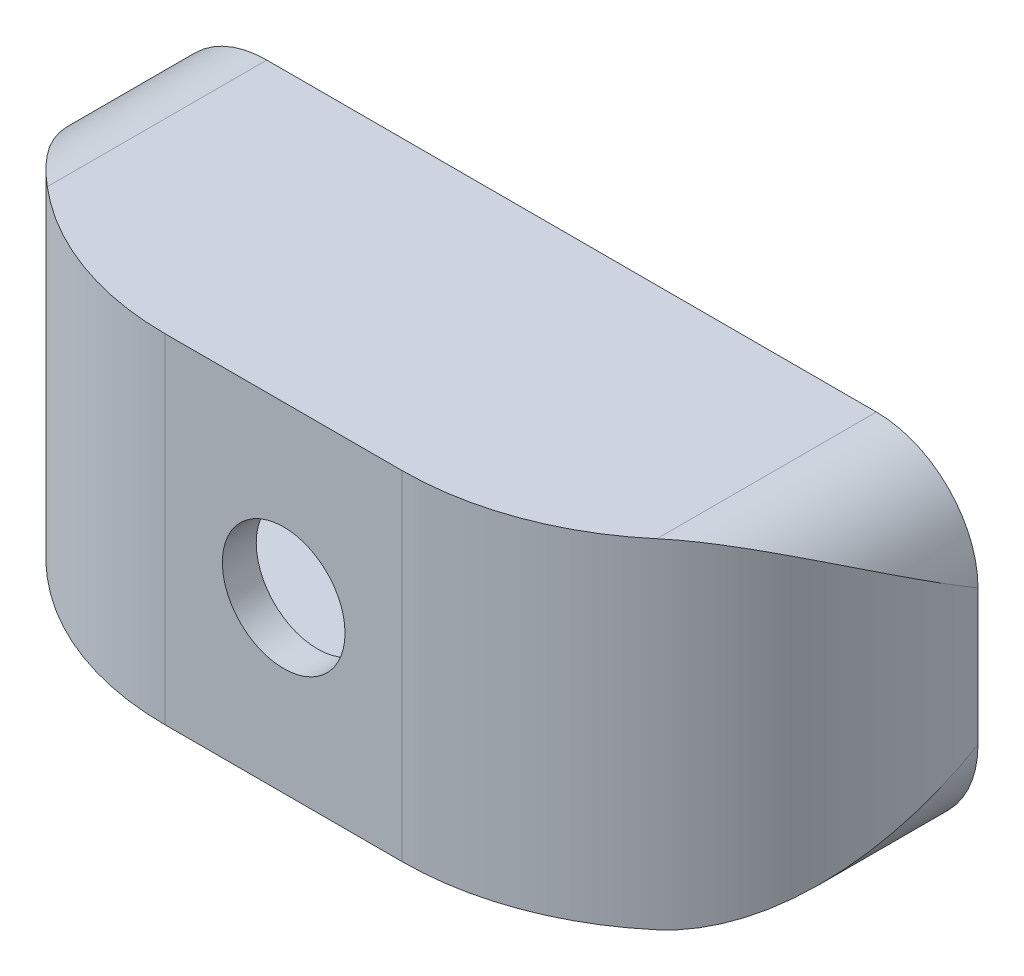
from build123d import *

# Parameters (mm, degrees)
BOSS_EXTRUDE2_DEPTH      = 44.45
BOSS_EXTRUDE2_DEPTH_BACK = 19.05
CUT_EXTRUDE_THIN1_DEPTH  = 104.419258966
SHELL1_T                 = -6.35
SKETCH5_R                = 11.5
CUT_EXTRUDE1_DEPTH       = 6.35
BOSS_EXTRUDE3_REACH      = 105.419
SKETCH8_W                = 9.525
SKETCH8_H                = 9.525
SKETCH8_R                = 1.5
FILLET1_R                = 2.54


with BuildPart() as part:
    # Sketch3 → Boss-Extrude2 (new, two sides: drawn at the far end of the back side and taken through both)
    with BuildSketch(Plane(origin=(0, 0, 0), x_dir=(1, 0, 0), z_dir=(0, 1, 0)).offset(-BOSS_EXTRUDE2_DEPTH_BACK)):
        with BuildLine():
            Line((-76.2, 0), (76.2, 0))
            ThreePointArc((76.2, 0), (60.391088515, -38.166088515), (22.225, -53.975))
            Line((22.225, -53.975), (-22.225, -53.975))
            ThreePointArc((-22.225, -53.975), (-60.391088515, -38.166088515), (-76.2, 0))
        make_face()
    extrude(amount=BOSS_EXTRUDE2_DEPTH + BOSS_EXTRUDE2_DEPTH_BACK)

    # Sketch4 → Cut-Extrude-Thin1 (cut, through all)
    with BuildSketch(Plane.XY.offset(53.975)):
        with BuildLine():
            Line((88.9, 25.4), (88.9, 0))
            ThreePointArc((88.9, 0), (79.600640303, -22.450640303), (57.15, -31.75))
            Line((57.15, -31.75), (-57.15, -31.75))
            ThreePointArc((-57.15, -31.75), (-79.600640303, -22.450640303), (-88.9, 0))
            Line((-88.9, 0), (-88.9, 25.4))
            ThreePointArc((-88.9, 25.4), (-79.600640303, 47.850640303), (-57.15, 57.15))
            Line((-57.15, 57.15), (57.15, 57.15))
            ThreePointArc((57.15, 57.15), (79.600640303, 47.850640303), (88.9, 25.4))
        make_face()
        with BuildLine():
            Line((76.2, 25.4), (76.2, 0))
            ThreePointArc((76.2, 0), (70.620384182, -13.470384182), (57.15, -19.05))
            Line((57.15, -19.05), (-57.15, -19.05))
            ThreePointArc((-57.15, -19.05), (-70.620384182, -13.470384182), (-76.2, 0))
            Line((-76.2, 0), (-76.2, 25.4))
            ThreePointArc((-76.2, 25.4), (-70.620384182, 38.870384182), (-57.15, 44.45))
            Line((-57.15, 44.45), (57.15, 44.45))
            ThreePointArc((57.15, 44.45), (70.620384182, 38.870384182), (76.2, 25.4))
        make_face(mode=Mode.SUBTRACT)
    extrude(amount=-CUT_EXTRUDE_THIN1_DEPTH, mode=Mode.SUBTRACT)

    # Shell1
    shell1_openings = [part.faces().sort_by_distance(p)[0] for p in [
        (0, 12.7, 0),
    ]]
    offset(amount=SHELL1_T, openings=shell1_openings)

    # Sketch5 → Cut-Extrude1 (cut)
    with BuildSketch(Plane.XY.offset(53.975)):
        with Locations((0, 12.7)):
            Circle(SKETCH5_R)
    extrude(amount=-CUT_EXTRUDE1_DEPTH, mode=Mode.SUBTRACT)

    # Sketch8 → Boss-Extrude3 (add, up to next)
    with BuildSketch(Plane(origin=(0, 0, 0), x_dir=(-1, 0, 0), z_dir=(0, 0, -1)), mode=Mode.PRIVATE) as boss_extrude3_sk1:
        with Locations((-47.625, 33.3375)):
            Rectangle(SKETCH8_W, SKETCH8_H)
        with Locations((-47.625, 33.3375)):
            Circle(SKETCH8_R, mode=Mode.SUBTRACT)
    boss_extrude3_tool1 = extrude(boss_extrude3_sk1.sketch, amount=-BOSS_EXTRUDE3_REACH, mode=Mode.PRIVATE) - part.part
    # Sketch8 → Boss-Extrude3 (add, up to next)
    with BuildSketch(Plane(origin=(0, 0, 0), x_dir=(-1, 0, 0), z_dir=(0, 0, -1)), mode=Mode.PRIVATE) as boss_extrude3_sk2:
        with Locations((-57.15, -7.9375)):
            Rectangle(SKETCH8_W, SKETCH8_H)
        with Locations((-57.15, -7.9375)):
            Circle(SKETCH8_R, mode=Mode.SUBTRACT)
    boss_extrude3_tool2 = extrude(boss_extrude3_sk2.sketch, amount=-BOSS_EXTRUDE3_REACH, mode=Mode.PRIVATE) - part.part
    # Sketch8 → Boss-Extrude3 (add, up to next)
    with BuildSketch(Plane(origin=(0, 0, 0), x_dir=(-1, 0, 0), z_dir=(0, 0, -1)), mode=Mode.PRIVATE) as boss_extrude3_sk3:
        with Locations((57.15, -7.9375)):
            Rectangle(SKETCH8_W, SKETCH8_H)
        with Locations((57.15, -7.9375)):
            Circle(SKETCH8_R, mode=Mode.SUBTRACT)
    boss_extrude3_tool3 = extrude(boss_extrude3_sk3.sketch, amount=-BOSS_EXTRUDE3_REACH, mode=Mode.PRIVATE) - part.part
    # Sketch8 → Boss-Extrude3 (add, up to next)
    with BuildSketch(Plane(origin=(0, 0, 0), x_dir=(-1, 0, 0), z_dir=(0, 0, -1)), mode=Mode.PRIVATE) as boss_extrude3_sk4:
        with Locations((47.625, 33.3375)):
            Rectangle(SKETCH8_W, SKETCH8_H)
        with Locations((47.625, 33.3375)):
            Circle(SKETCH8_R, mode=Mode.SUBTRACT)
    boss_extrude3_tool4 = extrude(boss_extrude3_sk4.sketch, amount=-BOSS_EXTRUDE3_REACH, mode=Mode.PRIVATE) - part.part
    add(boss_extrude3_tool1.solids().sort_by_distance((47.625, 28.709704, 0))[0])
    add(boss_extrude3_tool2.solids().sort_by_distance((57.15, -3.309704, 0))[0])
    add(boss_extrude3_tool3.solids().sort_by_distance((-52.522204, -7.9375, 0))[0])
    add(boss_extrude3_tool4.solids().sort_by_distance((-47.625, 28.709704, 0))[0])

    # Fillet1
    fillet1_edges = [part.edges().sort_by_distance(p)[0] for p in [
        (42.8625, 28.575, 21.460628012),
        (52.3875, 28.575, 18.427996491),
        (61.9125, -3.175, 13.162854637),
        (52.3875, -3.175, 18.427996491),
        (-52.3875, -3.175, 18.427996491),
        (-61.9125, -3.175, 13.162854637),
        (-52.3875, 28.575, 18.427996491),
        (-42.8625, 28.575, 21.460628012),
    ]]
    fillet(fillet1_edges, radius=FILLET1_R)


solid = part.part
